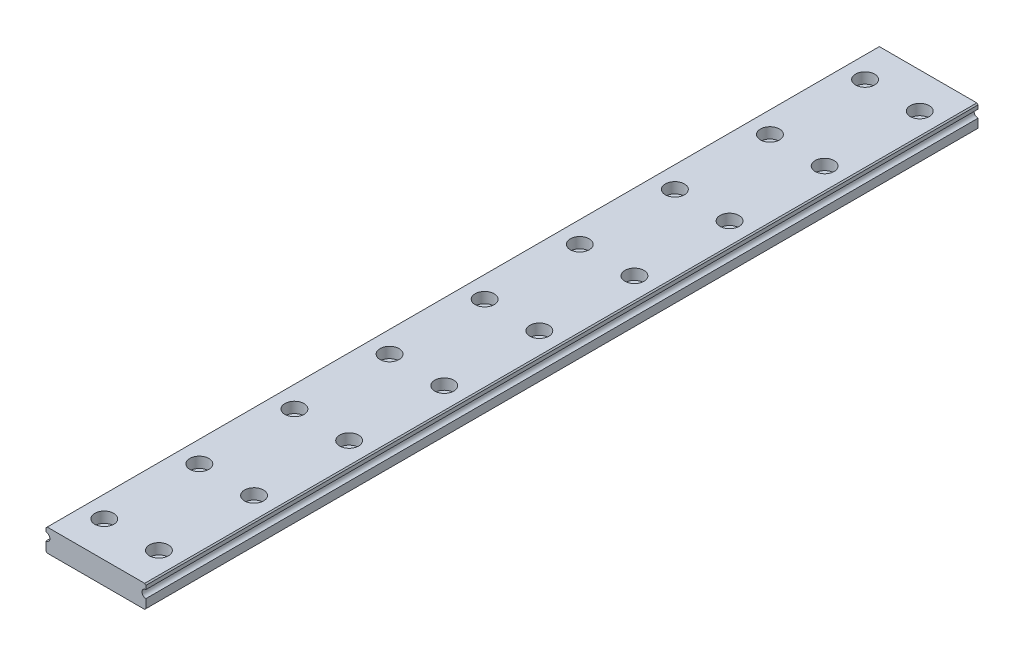
from build123d import *

# Parameters (mm, degrees)
BOSS_EXTRUDE1_DEPTH = 350


with BuildPart() as part:
    # Sketch1 → Boss-Extrude1 (new body)
    with BuildSketch(Plane.XY):
        with BuildLine():
            Line((-21, 9.005025253), (-21, 7.456))
            ThreePointArc((-21, 7.456), (-19.36, 5.816), (-21, 4.176))
            Line((-21, 4.176), (-21, 0.494974747))
            Line((-21, 0.494974747), (-20.505025253, 0))
            Line((-20.505025253, 0), (20.505025253, 0))
            Line((20.505025253, 0), (21, 0.494974747))
            Line((21, 0.494974747), (21, 4.176))
            ThreePointArc((21, 4.176), (19.36, 5.816), (21, 7.456))
            Line((21, 7.456), (21, 9.005025253))
            Line((21, 9.005025253), (20.505025253, 9.5))
            Line((20.505025253, 9.5), (-20.505025253, 9.5))
            Line((-20.505025253, 9.5), (-21, 9.005025253))
        make_face()
    extrude(amount=BOSS_EXTRUDE1_DEPTH)

    # Sketch2 → Cut-Revolve1 (revolve, cut)
    with BuildSketch(Plane(origin=(11.5, 0, 0), x_dir=(0, 0, -1), z_dir=(1, 0, 0)), mode=Mode.PRIVATE) as cut_revolve1_sk:
        Polygon((-15, 9.5), (-11, 9.5), (-11, 5), (-12.75, 5), (-12.75, 0), (-15, 0), align=None)
    revolve(cut_revolve1_sk.sketch.rotate(Axis((11.5, 0, 15), (0, 1, 0)), 180), axis=Axis((11.5, 0, 15), (0, 1, 0)), mode=Mode.SUBTRACT)

    # Sketch3 → Cut-Revolve2 (revolve, cut)
    with BuildSketch(Plane(origin=(11.5, 0, 0), x_dir=(0, 0, -1), z_dir=(1, 0, 0)), mode=Mode.PRIVATE) as cut_revolve2_sk:
        Polygon((-335, 9.5), (-331, 9.5), (-331, 5), (-332.75, 5), (-332.75, 0), (-335, 0), align=None)
    revolve(cut_revolve2_sk.sketch.rotate(Axis((11.5, 0, 335), (0, 1, 0)), 180), axis=Axis((11.5, 0, 335), (0, 1, 0)), mode=Mode.SUBTRACT)

    # Sketch4 → Cut-Revolve3 (revolve, cut)
    with BuildSketch(Plane(origin=(-11.5, 0, 0), x_dir=(0, 0, -1), z_dir=(1, 0, 0)), mode=Mode.PRIVATE) as cut_revolve3_sk:
        Polygon((-335, 9.5), (-331, 9.5), (-331, 5), (-332.75, 5), (-332.75, 0), (-335, 0), align=None)
    revolve(cut_revolve3_sk.sketch.rotate(Axis((-11.5, 0, 335), (0, 1, 0)), 180), axis=Axis((-11.5, 0, 335), (0, 1, 0)), mode=Mode.SUBTRACT)

    # Sketch5 → Cut-Revolve4 (revolve, cut)
    with BuildSketch(Plane(origin=(11.5, 0, 0), x_dir=(0, 0, -1), z_dir=(1, 0, 0)), mode=Mode.PRIVATE) as cut_revolve4_sk:
        Polygon((-295, 9.5), (-291, 9.5), (-291, 5), (-292.75, 5), (-292.75, 0), (-295, 0), align=None)
    revolve(cut_revolve4_sk.sketch.rotate(Axis((11.5, 0, 295), (0, 1, 0)), 180), axis=Axis((11.5, 0, 295), (0, 1, 0)), mode=Mode.SUBTRACT)

    # Sketch6 → Cut-Revolve5 (revolve, cut)
    with BuildSketch(Plane(origin=(-11.5, 0, 0), x_dir=(0, 0, -1), z_dir=(1, 0, 0)), mode=Mode.PRIVATE) as cut_revolve5_sk:
        Polygon((-295, 9.5), (-291, 9.5), (-291, 5), (-292.75, 5), (-292.75, 0), (-295, 0), align=None)
    revolve(cut_revolve5_sk.sketch.rotate(Axis((-11.5, 0, 295), (0, 1, 0)), 180), axis=Axis((-11.5, 0, 295), (0, 1, 0)), mode=Mode.SUBTRACT)

    # Sketch7 → Cut-Revolve6 (revolve, cut)
    with BuildSketch(Plane(origin=(11.5, 0, 0), x_dir=(0, 0, -1), z_dir=(1, 0, 0)), mode=Mode.PRIVATE) as cut_revolve6_sk:
        Polygon((-255, 9.5), (-251, 9.5), (-251, 5), (-252.75, 5), (-252.75, 0), (-255, 0), align=None)
    revolve(cut_revolve6_sk.sketch.rotate(Axis((11.5, 0, 255), (0, 1, 0)), 180), axis=Axis((11.5, 0, 255), (0, 1, 0)), mode=Mode.SUBTRACT)

    # Sketch8 → Cut-Revolve7 (revolve, cut)
    with BuildSketch(Plane(origin=(-11.5, 0, 0), x_dir=(0, 0, -1), z_dir=(1, 0, 0)), mode=Mode.PRIVATE) as cut_revolve7_sk:
        Polygon((-255, 9.5), (-251, 9.5), (-251, 5), (-252.75, 5), (-252.75, 0), (-255, 0), align=None)
    revolve(cut_revolve7_sk.sketch.rotate(Axis((-11.5, 0, 255), (0, 1, 0)), 180), axis=Axis((-11.5, 0, 255), (0, 1, 0)), mode=Mode.SUBTRACT)

    # Sketch9 → Cut-Revolve8 (revolve, cut)
    with BuildSketch(Plane(origin=(11.5, 0, 0), x_dir=(0, 0, -1), z_dir=(1, 0, 0)), mode=Mode.PRIVATE) as cut_revolve8_sk:
        Polygon((-215, 9.5), (-211, 9.5), (-211, 5), (-212.75, 5), (-212.75, 0), (-215, 0), align=None)
    revolve(cut_revolve8_sk.sketch.rotate(Axis((11.5, 0, 215), (0, 1, 0)), 180), axis=Axis((11.5, 0, 215), (0, 1, 0)), mode=Mode.SUBTRACT)

    # Sketch10 → Cut-Revolve9 (revolve, cut)
    with BuildSketch(Plane(origin=(-11.5, 0, 0), x_dir=(0, 0, -1), z_dir=(1, 0, 0)), mode=Mode.PRIVATE) as cut_revolve9_sk:
        Polygon((-215, 9.5), (-211, 9.5), (-211, 5), (-212.75, 5), (-212.75, 0), (-215, 0), align=None)
    revolve(cut_revolve9_sk.sketch.rotate(Axis((-11.5, 0, 215), (0, 1, 0)), 180), axis=Axis((-11.5, 0, 215), (0, 1, 0)), mode=Mode.SUBTRACT)

    # Sketch11 → Cut-Revolve10 (revolve, cut)
    with BuildSketch(Plane(origin=(11.5, 0, 0), x_dir=(0, 0, -1), z_dir=(1, 0, 0)), mode=Mode.PRIVATE) as cut_revolve10_sk:
        Polygon((-175, 9.5), (-171, 9.5), (-171, 5), (-172.75, 5), (-172.75, 0), (-175, 0), align=None)
    revolve(cut_revolve10_sk.sketch.rotate(Axis((11.5, 0, 175), (0, 1, 0)), 180), axis=Axis((11.5, 0, 175), (0, 1, 0)), mode=Mode.SUBTRACT)

    # Sketch12 → Cut-Revolve11 (revolve, cut)
    with BuildSketch(Plane(origin=(-11.5, 0, 0), x_dir=(0, 0, -1), z_dir=(1, 0, 0)), mode=Mode.PRIVATE) as cut_revolve11_sk:
        Polygon((-175, 9.5), (-171, 9.5), (-171, 5), (-172.75, 5), (-172.75, 0), (-175, 0), align=None)
    revolve(cut_revolve11_sk.sketch.rotate(Axis((-11.5, 0, 175), (0, 1, 0)), 180), axis=Axis((-11.5, 0, 175), (0, 1, 0)), mode=Mode.SUBTRACT)

    # Sketch13 → Cut-Revolve12 (revolve, cut)
    with BuildSketch(Plane(origin=(11.5, 0, 0), x_dir=(0, 0, -1), z_dir=(1, 0, 0)), mode=Mode.PRIVATE) as cut_revolve12_sk:
        Polygon((-135, 9.5), (-131, 9.5), (-131, 5), (-132.75, 5), (-132.75, 0), (-135, 0), align=None)
    revolve(cut_revolve12_sk.sketch.rotate(Axis((11.5, 0, 135), (0, 1, 0)), 180), axis=Axis((11.5, 0, 135), (0, 1, 0)), mode=Mode.SUBTRACT)

    # Sketch14 → Cut-Revolve13 (revolve, cut)
    with BuildSketch(Plane(origin=(-11.5, 0, 0), x_dir=(0, 0, -1), z_dir=(1, 0, 0)), mode=Mode.PRIVATE) as cut_revolve13_sk:
        Polygon((-135, 9.5), (-131, 9.5), (-131, 5), (-132.75, 5), (-132.75, 0), (-135, 0), align=None)
    revolve(cut_revolve13_sk.sketch.rotate(Axis((-11.5, 0, 135), (0, 1, 0)), 180), axis=Axis((-11.5, 0, 135), (0, 1, 0)), mode=Mode.SUBTRACT)

    # Sketch15 → Cut-Revolve14 (revolve, cut)
    with BuildSketch(Plane(origin=(11.5, 0, 0), x_dir=(0, 0, -1), z_dir=(1, 0, 0)), mode=Mode.PRIVATE) as cut_revolve14_sk:
        Polygon((-95, 9.5), (-91, 9.5), (-91, 5), (-92.75, 5), (-92.75, 0), (-95, 0), align=None)
    revolve(cut_revolve14_sk.sketch.rotate(Axis((11.5, 0, 95), (0, 1, 0)), 180), axis=Axis((11.5, 0, 95), (0, 1, 0)), mode=Mode.SUBTRACT)

    # Sketch16 → Cut-Revolve15 (revolve, cut)
    with BuildSketch(Plane(origin=(-11.5, 0, 0), x_dir=(0, 0, -1), z_dir=(1, 0, 0)), mode=Mode.PRIVATE) as cut_revolve15_sk:
        Polygon((-95, 9.5), (-91, 9.5), (-91, 5), (-92.75, 5), (-92.75, 0), (-95, 0), align=None)
    revolve(cut_revolve15_sk.sketch.rotate(Axis((-11.5, 0, 95), (0, 1, 0)), 180), axis=Axis((-11.5, 0, 95), (0, 1, 0)), mode=Mode.SUBTRACT)

    # Sketch17 → Cut-Revolve16 (revolve, cut)
    with BuildSketch(Plane(origin=(11.5, 0, 0), x_dir=(0, 0, -1), z_dir=(1, 0, 0)), mode=Mode.PRIVATE) as cut_revolve16_sk:
        Polygon((-55, 9.5), (-51, 9.5), (-51, 5), (-52.75, 5), (-52.75, 0), (-55, 0), align=None)
    revolve(cut_revolve16_sk.sketch.rotate(Axis((11.5, 0, 55), (0, 1, 0)), 180), axis=Axis((11.5, 0, 55), (0, 1, 0)), mode=Mode.SUBTRACT)

    # Sketch18 → Cut-Revolve17 (revolve, cut)
    with BuildSketch(Plane(origin=(-11.5, 0, 0), x_dir=(0, 0, -1), z_dir=(1, 0, 0)), mode=Mode.PRIVATE) as cut_revolve17_sk:
        Polygon((-55, 9.5), (-51, 9.5), (-51, 5), (-52.75, 5), (-52.75, 0), (-55, 0), align=None)
    revolve(cut_revolve17_sk.sketch.rotate(Axis((-11.5, 0, 55), (0, 1, 0)), 180), axis=Axis((-11.5, 0, 55), (0, 1, 0)), mode=Mode.SUBTRACT)

    # Sketch19 → Cut-Revolve18 (revolve, cut)
    with BuildSketch(Plane(origin=(-11.5, 0, 0), x_dir=(0, 0, -1), z_dir=(1, 0, 0)), mode=Mode.PRIVATE) as cut_revolve18_sk:
        Polygon((-15, 9.5), (-11, 9.5), (-11, 5), (-12.75, 5), (-12.75, 0), (-15, 0), align=None)
    revolve(cut_revolve18_sk.sketch.rotate(Axis((-11.5, 0, 15), (0, 1, 0)), 180), axis=Axis((-11.5, 0, 15), (0, 1, 0)), mode=Mode.SUBTRACT)


solid = part.part
